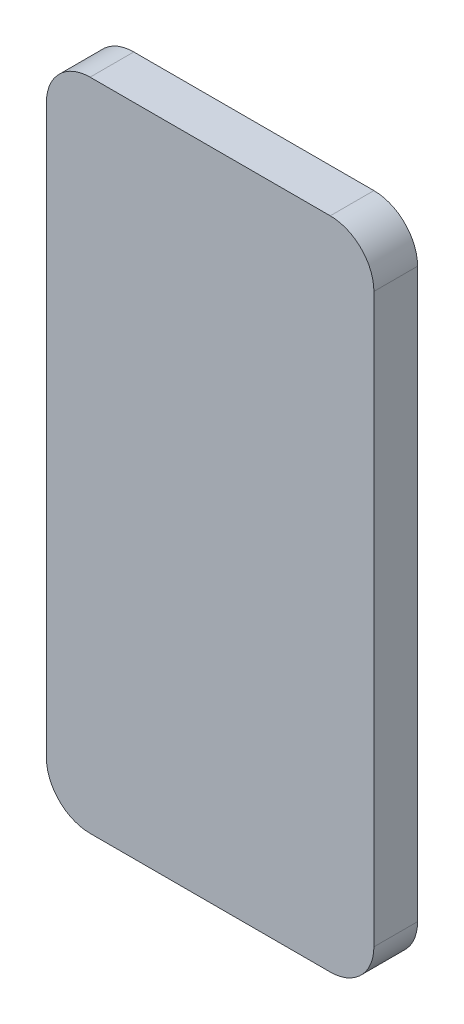
from build123d import *

# Parameters (mm, degrees)
SKETCH2_W           = 75
SKETCH2_H           = 150
BOSS_EXTRUDE2_DEPTH = 10
FILLET2_R           = 10


with BuildPart() as part:
    # Sketch2 → Boss-Extrude2 (new body)
    with BuildSketch(Plane.XY):
        with Locations((37.5, 75)):
            Rectangle(SKETCH2_W, SKETCH2_H)
    extrude(amount=BOSS_EXTRUDE2_DEPTH)

    # Fillet2
    fillet2_edges = [part.edges().sort_by_distance(p)[0] for p in [
        (0, 150, 5),
        (75, 150, 5),
        (75, 0, 5),
        (0, 0, 5),
    ]]
    fillet(fillet2_edges, radius=FILLET2_R)


solid = part.part
